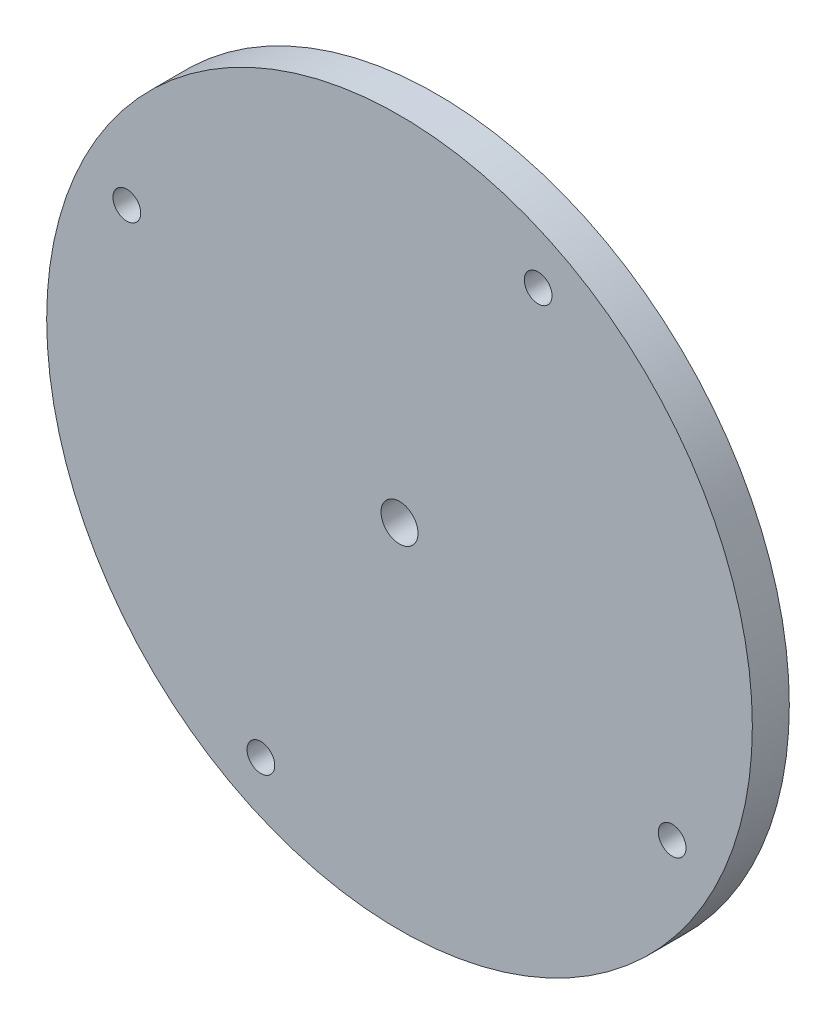
from build123d import *

# Parameters (mm, degrees)
SKETCH1_R           = 3
BOSS_EXTRUDE3_DEPTH = 8
SKETCH2_R           = 4
CUT_EXTRUDE1_DEPTH  = 109.271164213


with BuildPart() as part:
    # Sketch1 → Boss-Extrude3 (new body)
    # profile 1 of 5: a face of its own
    with BuildSketch(Plane.XY):
        with BuildLine():
            ThreePointArc((76.35, 0), (53.987602744, 53.987602744), (0, 76.35))
            ThreePointArc((0, 76.35), (-62.014972319, 44.536116897), (-72.348554199, -24.392810524))
            ThreePointArc((-72.348554199, -24.392810524), (-44.536116897, -62.014972319), (0, -76.35))
            ThreePointArc((0, -76.35), (53.987602744, -53.987602744), (76.35, 0))
        make_face()
        Polygon((-27.25, -54.236860279), (-24.5, -59), (-27.25, -63.763139721), (-32.75, -63.763139721), (-35.5, -59), (-32.75, -54.236860279), align=None, mode=Mode.SUBTRACT)
        Polygon((54.236860279, -27.25), (59, -24.5), (63.763139721, -27.25), (63.763139721, -32.75), (59, -35.5), (54.236860279, -32.75), align=None, mode=Mode.SUBTRACT)
        Polygon((-54.236860279, 27.25), (-59, 24.5), (-63.763139721, 27.25), (-63.763139721, 32.75), (-59, 35.5), (-54.236860279, 32.75), align=None, mode=Mode.SUBTRACT)
        Polygon((27.25, 54.236860279), (24.5, 59), (27.25, 63.763139721), (32.75, 63.763139721), (35.5, 59), (32.75, 54.236860279), align=None, mode=Mode.SUBTRACT)
    # profile 2 of 5: a face of its own
    with BuildSketch(Plane.XY):
        Polygon((-63.763139721, 32.75), (-63.763139721, 27.25), (-59, 24.5), (-54.236860279, 27.25), (-54.236860279, 32.75), (-59, 35.5), align=None)
        with Locations((-59, 30)):
            Circle(SKETCH1_R, mode=Mode.SUBTRACT)
    # profile 3 of 5: a face of its own
    with BuildSketch(Plane.XY):
        Polygon((32.75, 63.763139721), (27.25, 63.763139721), (24.5, 59), (27.25, 54.236860279), (32.75, 54.236860279), (35.5, 59), align=None)
        with Locations((30, 59)):
            Circle(SKETCH1_R, mode=Mode.SUBTRACT)
    # profile 4 of 5: a face of its own
    with BuildSketch(Plane.XY):
        Polygon((63.763139721, -32.75), (63.763139721, -27.25), (59, -24.5), (54.236860279, -27.25), (54.236860279, -32.75), (59, -35.5), align=None)
        with Locations((59, -30)):
            Circle(SKETCH1_R, mode=Mode.SUBTRACT)
    # profile 5 of 5: a face of its own
    with BuildSketch(Plane.XY):
        Polygon((-32.75, -63.763139721), (-27.25, -63.763139721), (-24.5, -59), (-27.25, -54.236860279), (-32.75, -54.236860279), (-35.5, -59), align=None)
        with Locations((-30, -59)):
            Circle(SKETCH1_R, mode=Mode.SUBTRACT)
    extrude(amount=BOSS_EXTRUDE3_DEPTH)

    # Sketch2 → Cut-Extrude1 (cut, through all)
    with BuildSketch(Plane.XY.offset(8)):
        Circle(SKETCH2_R)
    extrude(amount=-CUT_EXTRUDE1_DEPTH, mode=Mode.SUBTRACT)


solid = part.part
